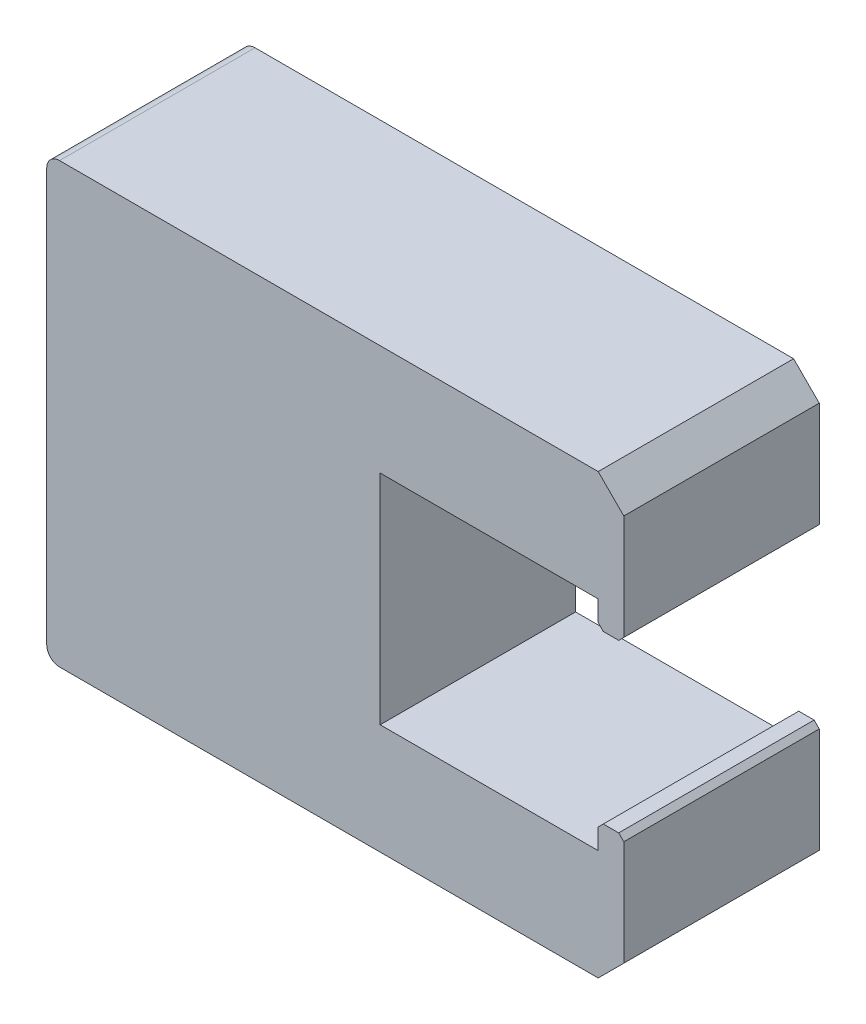
from build123d import *

# Parameters (mm, degrees)
BOSS_EXTRUDE1_DEPTH = 38.1
CHAMFER1_SIZE       = 10
CHAMFER2_SIZE       = 2
FILLET1_R           = 5


with BuildPart() as part:
    # Sketch1 → Boss-Extrude1 (new, symmetric)
    with BuildSketch(Plane.XY):
        Polygon((0, 0), (225, 0), (225, 53), (215, 53), (215, 43), (130, 43), (130, 128), (215, 128), (215, 118), (225, 118), (225, 171), (0, 171), align=None)
    extrude(amount=BOSS_EXTRUDE1_DEPTH, both=True)

    # Chamfer1
    chamfer1_edges = [part.edges().sort_by_distance(p)[0] for p in [
        (225, 0, 0),
        (225, 171, 0),
    ]]
    chamfer(chamfer1_edges, length=CHAMFER1_SIZE)

    # Chamfer2
    chamfer2_edges = [part.edges().sort_by_distance(p)[0] for p in [
        (215, 118, 0),
        (215, 53, 0),
        (225, 118, 0),
        (225, 53, 0),
    ]]
    chamfer(chamfer2_edges, length=CHAMFER2_SIZE)

    # Fillet1
    fillet1_edges = [part.edges().sort_by_distance(p)[0] for p in [
        (0, 171, 0),
        (0, 0, 0),
    ]]
    fillet(fillet1_edges, radius=FILLET1_R)


solid = part.part
